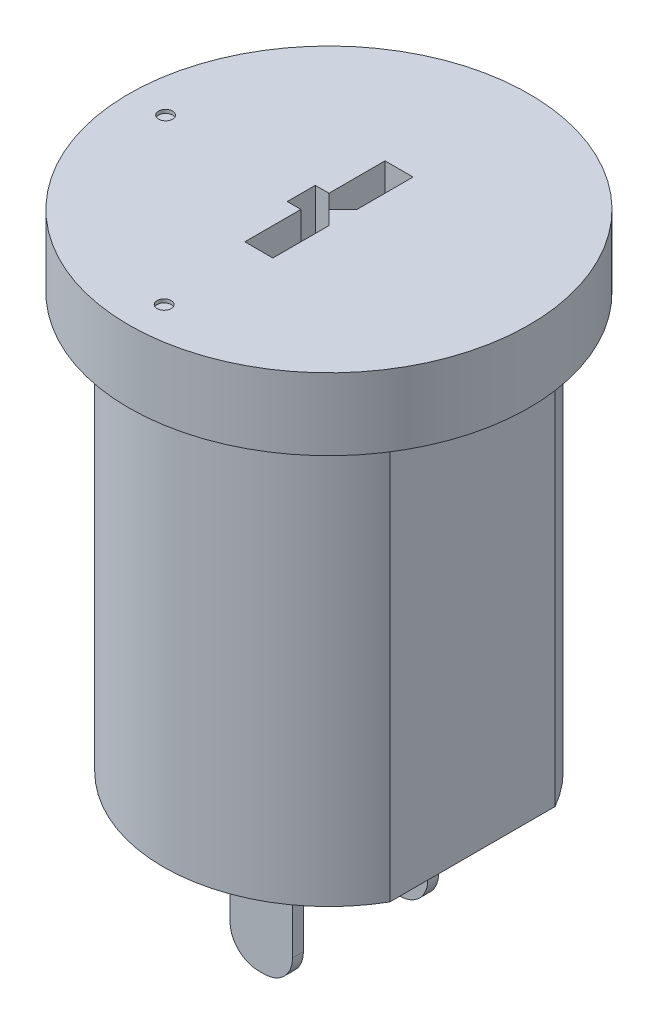
from build123d import *

# Parameters (mm, degrees)
SKETCH2_W           = 3.302901435
SKETCH2_H           = 13.888103622
CUT_EXTRUDE1_DEPTH  = 15.0276
SKETCH3_W           = 2.2606
SKETCH3_H           = 0.3937
BOSS_EXTRUDE1_DEPTH = 5.08
FILLET1_R           = 1.016
CUT_EXTRUDE2_DEPTH  = 2.54
SKETCH5_R           = 0.254
CUT_EXTRUDE3_DEPTH  = 0.127


with BuildPart() as part:
    # Sketch1 → Revolve1 (revolve)
    with BuildSketch(Plane.XY, mode=Mode.PRIVATE) as revolve1_sk:
        Polygon((0, 17.6276), (-7.25, 17.6276), (-7.25, 15.0276), (-6, 15.0276), (-6, 0), (0, 0), align=None)
    revolve(revolve1_sk.sketch.rotate(Axis((0, 19.222907737, 0), (0, -1, 0)), 270), axis=Axis((0, 19.222907737, 0), (0, -1, 0)))

    # Sketch2 → Cut-Extrude1 (cut)
    with BuildSketch(Plane.XZ):
        with Locations((-6.851450718, -0.431101593)):
            Rectangle(SKETCH2_W, SKETCH2_H)
        with Locations((6.851450718, -0.431101593)):
            Rectangle(SKETCH2_W, SKETCH2_H)
    extrude(amount=-CUT_EXTRUDE1_DEPTH, mode=Mode.SUBTRACT)

    # Sketch3 → Boss-Extrude1 (add)
    with BuildSketch(Plane.XZ):
        with Locations((0, 2.25315)):
            Rectangle(SKETCH3_W, SKETCH3_H)
        with Locations((0, -2.64685)):
            Rectangle(SKETCH3_W, SKETCH3_H)
    extrude(amount=BOSS_EXTRUDE1_DEPTH)

    # Fillet1
    fillet1_edges = [part.edges().sort_by_distance(p)[0] for p in [
        (1.1303, -5.08, 2.25315),
        (-1.1303, -5.08, 2.25315),
        (1.1303, -5.08, -2.64685),
        (-1.1303, -5.08, -2.64685),
    ]]
    fillet(fillet1_edges, radius=FILLET1_R)

    # Sketch4 → Cut-Extrude2 (cut)
    with BuildSketch(Plane(origin=(0, 17.6276, 0), x_dir=(1, 0, 0), z_dir=(0, 1, 0))):
        Polygon((0.508, 2.54), (0.508, 0.506703339), (0, 0), (0.508, -0.509299979), (0.508, -2.54), (-0.508, -2.54), (-0.508, -0.508), (-1.003091962, -0.508), (-1.003091962, 0.508), (-0.508, 0.508), (-0.508, 2.54), align=None)
    extrude(amount=-CUT_EXTRUDE2_DEPTH, mode=Mode.SUBTRACT)

    # Sketch5 → Cut-Extrude3 (cut)
    with BuildSketch(Plane(origin=(0, 17.6276, 0), x_dir=(1, 0, 0), z_dir=(0, 1, 0))):
        with Locations(Location((-5.91604032, 0, 0), (0, 0, 270))):
            Circle(SKETCH5_R)
        with Locations(Location((0, -5.969098978, 0), (0, 0, 270))):
            Circle(SKETCH5_R)
    extrude(amount=-CUT_EXTRUDE3_DEPTH, mode=Mode.SUBTRACT)


solid = part.part
